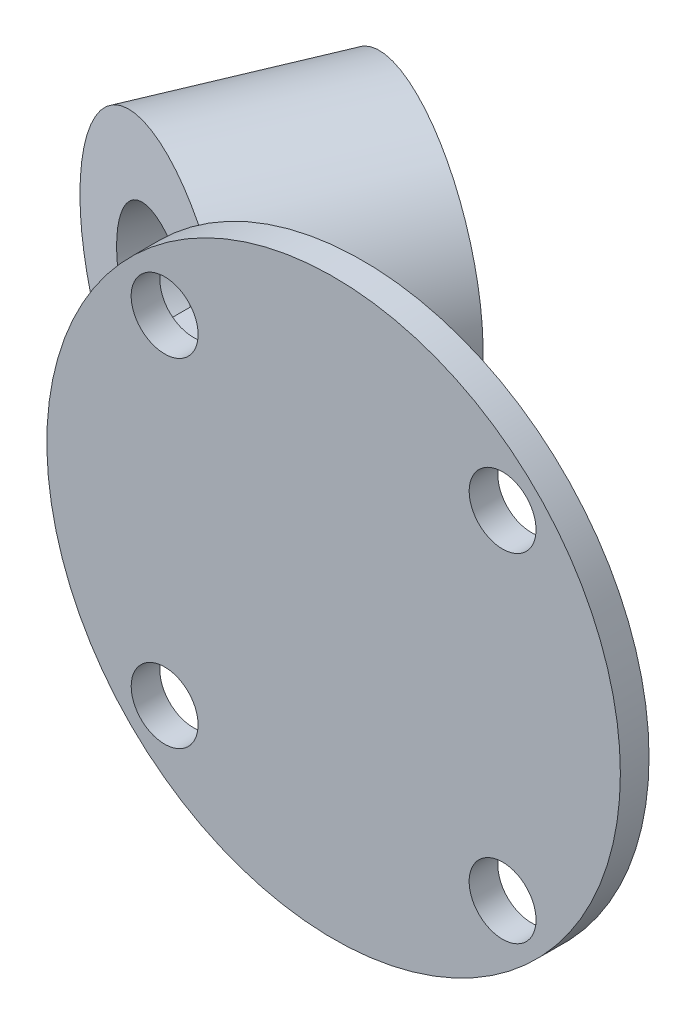
from build123d import *

# Parameters (mm, degrees)
SKETCH_2_R          = 30
EXTRUDE_1_DEPTH     = 3
SKETCH_3_R          = 3.5
CUT_EXTRUDE_1_DEPTH = 3
EXTRUDE_2_DEPTH     = 5


with BuildPart() as part:
    # 草图2 → 凸台-拉伸1 (new body)
    with BuildSketch(Plane.XY):
        Circle(SKETCH_2_R)
    extrude(amount=EXTRUDE_1_DEPTH)

    # 草图3 → 切除-拉伸1 (cut)
    with BuildSketch(Plane.XY.offset(3)):
        with Locations((-17.67766953, 17.67766953)):
            Circle(SKETCH_3_R)
        with Locations(Location((17.67766953, 17.67766953, 0), (0, 0, 180))):
            Circle(SKETCH_3_R)
        with Locations((17.67766953, -17.67766953)):
            Circle(SKETCH_3_R)
        with Locations(Location((-17.67766953, -17.67766953, 0), (0, 0, 180))):
            Circle(SKETCH_3_R)
    extrude(amount=-CUT_EXTRUDE_1_DEPTH, mode=Mode.SUBTRACT)



with BuildPart() as body_2:
    # 草图25 → 旋转2 (revolve)
    with BuildSketch(Plane(origin=(0, 0, 0), x_dir=(1, 0, 0), z_dir=(0, 1, 0)), mode=Mode.PRIVATE) as revolve_2_sk:
        Polygon((-29.758424065, 12.360243347), (-23.125174485, 9.560243347), (-15.347396707, 27.985936626), (-21.478005352, 30.573763904), align=None)
    revolve(revolve_2_sk.sketch.rotate(Axis((-35, 0, -20), (-0.3888888888888914, 0, 0.92128466398761)), 180), axis=Axis((-35, 0, -20), (-0.3888888888888914, 0, 0.92128466398761)))


with BuildPart() as part_1:
    add(part.part)

    add(body_2.part)  # 凸台-拉伸2 merges body 2
    # 草图26 → 凸台-拉伸2 (add, symmetric)
    with BuildSketch(Plane(origin=(0, 0, 0), x_dir=(1, 0, 0), z_dir=(0, 1, 0))):
        Polygon((-29.758424065, 12.360243347), (-29.758424065, 0), (0, 0), (-21.18073004, 14.166666667), (-26.769119447, 16.525614592), align=None)
    extrude(amount=EXTRUDE_2_DEPTH, both=True)


solid = part_1.part
